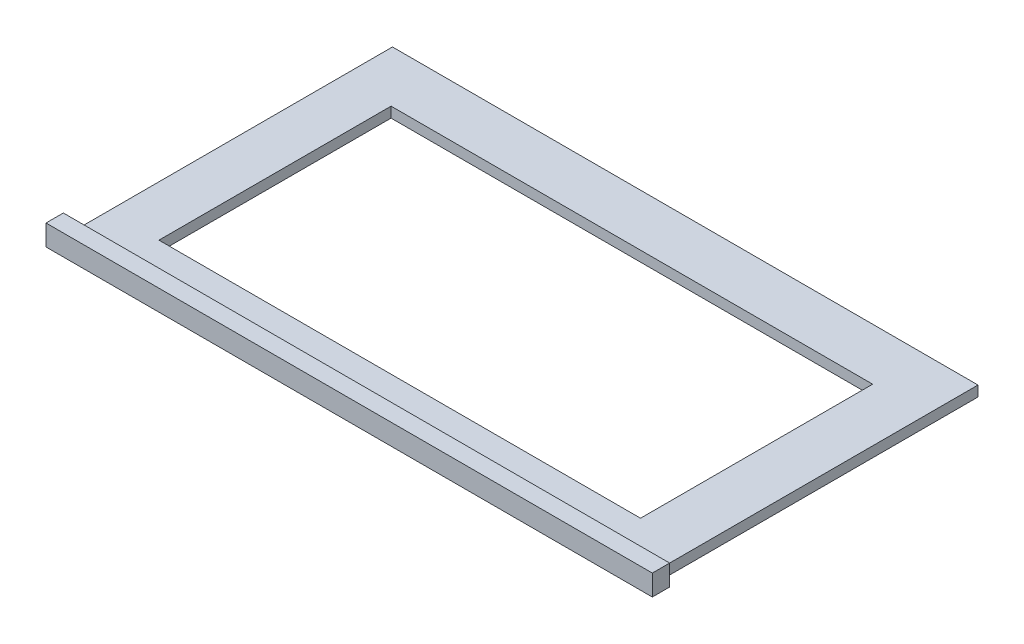
from build123d import *

# Parameters (mm, degrees)
SKETCH1_W           = 169
SKETCH1_H           = 6
BOSS_EXTRUDE1_DEPTH = 5
SKETCH2_W           = 169
SKETCH2_H           = 3
BOSS_EXTRUDE2_DEPTH = 92
SKETCH3_W           = 5
SKETCH3_H           = 6
BOSS_EXTRUDE3_DEPTH = 3
SKETCH4_W           = 5
SKETCH4_H           = 6
BOSS_EXTRUDE4_DEPTH = 3
SKETCH8_W           = 139
SKETCH8_H           = 67
CUT_EXTRUDE2_DEPTH  = 3


with BuildPart() as part:
    # Sketch1 → Boss-Extrude1 (new body)
    with BuildSketch(Plane.XY):
        Rectangle(SKETCH1_W, SKETCH1_H)
    extrude(amount=-BOSS_EXTRUDE1_DEPTH)

    # Sketch2 → Boss-Extrude2 (add)
    with BuildSketch(Plane(origin=(0, 0, -5), x_dir=(-1, 0, 0), z_dir=(0, 0, -1))):
        with Locations((0, -1.5)):
            Rectangle(SKETCH2_W, SKETCH2_H)
    extrude(amount=BOSS_EXTRUDE2_DEPTH)

    # Sketch3 → Boss-Extrude3 (add)
    with BuildSketch(Plane(origin=(84.5, 0, 0), x_dir=(0, 0, -1), z_dir=(1, 0, 0))):
        with Locations((2.5, 0)):
            Rectangle(SKETCH3_W, SKETCH3_H)
    extrude(amount=BOSS_EXTRUDE3_DEPTH)

    # Sketch4 → Boss-Extrude4 (add)
    with BuildSketch(Plane.ZY.offset(84.5)):
        with Locations((-2.5, 0)):
            Rectangle(SKETCH4_W, SKETCH4_H)
    extrude(amount=BOSS_EXTRUDE4_DEPTH)

    # Sketch8 → Cut-Extrude2 (cut)
    with BuildSketch(Plane(origin=(0, 0, 0), x_dir=(1, 0, 0), z_dir=(0, 1, 0))):
        with Locations((-0.408697147, 48.504527108)):
            Rectangle(SKETCH8_W, SKETCH8_H)
    extrude(amount=-CUT_EXTRUDE2_DEPTH, mode=Mode.SUBTRACT)


solid = part.part
